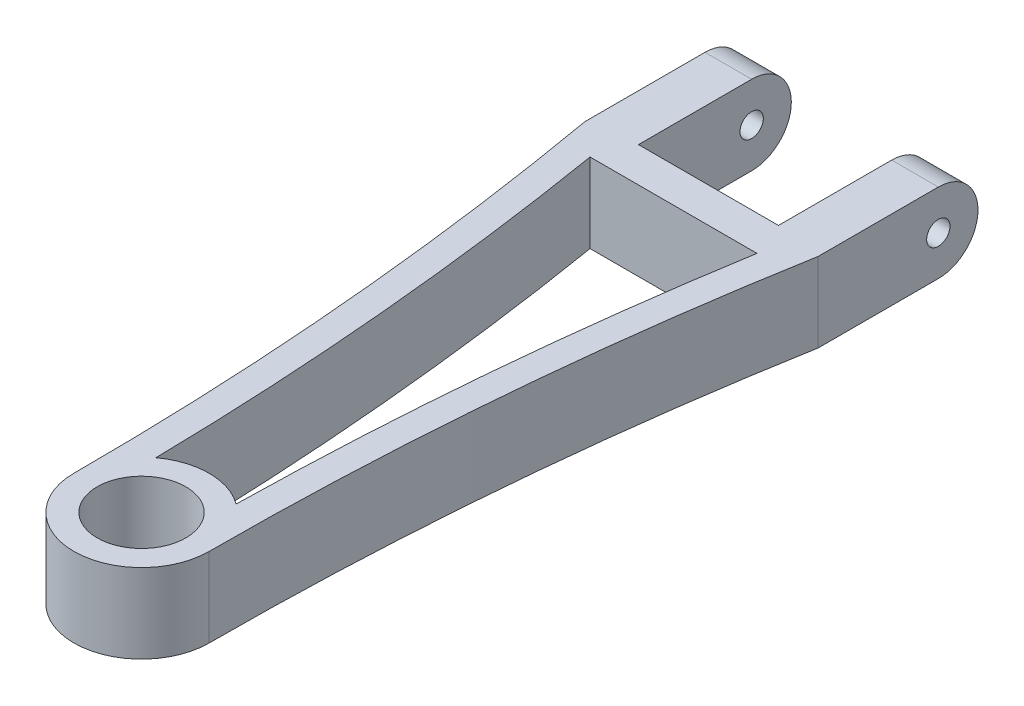
from build123d import *

# Parameters (mm, degrees)
SKETCH1_R               = 12.065
BOSS_EXTRUDE1_DEPTH     = 10.795
SKETCH5_W               = 38.1
SKETCH5_H               = 21.59
BOSS_EXTRUDE2_DEPTH     = 101.6
CUT_EXTRUDE1_REACH      = 261.255
SKETCH6_R               = 3.175
SKETCH4_W               = 12.7
SKETCH4_H               = 21.59
BOSS_EXTRUDE3_DEPTH     = 50.8
CUT_EXTRUDE2_DEPTH      = 210.73176208
CUT_EXTRUDE2_DEPTH_BACK = 210.73176208
SKETCH6_2_R             = 3.175
CUT_EXTRUDE3_DEPTH      = 214.164307578
CUT_EXTRUDE3_DEPTH_BACK = 214.164307578
CUT_EXTRUDE4_DEPTH      = 200.616791257
CUT_EXTRUDE4_DEPTH_BACK = 200.616791257


with BuildPart() as part:
    # Sketch1 → Boss-Extrude1 (new, symmetric)
    with BuildSketch(Plane(origin=(0, 0, 0), x_dir=(1, 0, 0), z_dir=(0, 1, 0))):
        with BuildLine():
            Line((-31.75, 152.4), (31.75, 152.4))
            ThreePointArc((31.75, 152.4), (21.755106695, 76.491146914), (18.415, 0))
            ThreePointArc((18.415, 0), (0, -18.415), (-18.415, 0))
            ThreePointArc((-18.415, 0), (-21.755106695, 76.491146914), (-31.75, 152.4))
        make_face()
        Circle(SKETCH1_R, mode=Mode.SUBTRACT)
    extrude(amount=BOSS_EXTRUDE1_DEPTH, both=True)

    # Sketch5 → Boss-Extrude2 (add)
    with BuildSketch(Plane(origin=(0, 0, -152.4), x_dir=(-1, 0, 0), z_dir=(0, 0, -1))):
        Rectangle(SKETCH5_W, SKETCH5_H)
    extrude(amount=BOSS_EXTRUDE2_DEPTH)

    # Sketch6 → Cut-Extrude1 (cut, up to next)
    with BuildSketch(Plane(origin=(19.05, 0, 0), x_dir=(0, 0, -1), z_dir=(1, 0, 0)), mode=Mode.PRIVATE) as cut_extrude1_sk1:
        Polygon((152.4, -10.795), (154.288880246, 10.795), (254, 10.795), (254, -10.795), align=None)
        with Locations((185.094440123, 0)):
            Circle(SKETCH6_R, mode=Mode.SUBTRACT)
    cut_extrude1_tool1 = extrude(cut_extrude1_sk1.sketch, amount=-CUT_EXTRUDE1_REACH, mode=Mode.PRIVATE) & part.part
    add(cut_extrude1_tool1.solids().sort_by_distance((19.05, -0.034262, -203.945458))[0], mode=Mode.SUBTRACT)


with BuildPart() as cut_extrude1_piece_1:
    # of the separate pieces the step leaves, piece 1, a body of its own (cut_extrude1_pieces)
    add(part.part.solids().sort_by_distance((-31.75, -10.795, -152.4))[0])

    # Sketch4 → Boss-Extrude3 (add)
    with BuildSketch(Plane(origin=(0, 0, -152.4), x_dir=(-1, 0, 0), z_dir=(0, 0, -1))):
        with Locations((-25.4, 0)):
            Rectangle(SKETCH4_W, SKETCH4_H)
        with Locations((25.4, 0)):
            Rectangle(SKETCH4_W, SKETCH4_H)
    extrude(amount=BOSS_EXTRUDE3_DEPTH)


with BuildPart() as cut_extrude1_piece_2:
    # of the separate pieces the step leaves, piece 2, a body of its own (cut_extrude1_pieces)
    add(part.part.solids().sort_by_distance((-19.05, 0, -188.269440123))[0])


with BuildPart() as cut_extrude2_tool:
    # Sketch6<2> → Cut-Extrude2 (new, two sides: drawn at the far end of the back side and taken through both)
    with BuildSketch(Plane(origin=(19.05, 0, 0), x_dir=(0, 0, -1), z_dir=(1, 0, 0)).offset(-CUT_EXTRUDE2_DEPTH_BACK)):
        with Locations((185.094440123, 0)):
            Circle(SKETCH6_2_R)
    extrude(amount=CUT_EXTRUDE2_DEPTH + CUT_EXTRUDE2_DEPTH_BACK)


with BuildPart() as cut_extrude1_piece_1_1:
    add(cut_extrude1_piece_1.part)

    # Cut-Extrude2: cut by cut_extrude2_tool
    add(cut_extrude2_tool.part, mode=Mode.SUBTRACT)

    # Sketch7 → Cut-Extrude3 (cut, two sides: drawn at the far end of the back side and taken through both)
    with BuildSketch(Plane(origin=(31.75, 0, 0), x_dir=(0, 0, -1), z_dir=(1, 0, 0)).offset(-CUT_EXTRUDE3_DEPTH_BACK)):
        with BuildLine():
            Line((203.2, 10.795), (185.094440123, 10.795))
            ThreePointArc((185.094440123, 10.795), (192.727657826, 7.633217703), (195.889440123, 0))
            ThreePointArc((195.889440123, 0), (192.727657826, -7.633217703), (185.094440123, -10.795))
            Line((185.094440123, -10.795), (203.2, -10.795))
            Line((203.2, -10.795), (203.2, 10.795))
        make_face()
    extrude(amount=CUT_EXTRUDE3_DEPTH + CUT_EXTRUDE3_DEPTH_BACK, mode=Mode.SUBTRACT)

    # Sketch8 → Cut-Extrude4 (cut, two sides: drawn at the far end of the back side and taken through both)
    with BuildSketch(Plane.XZ.offset(10.795).offset(-CUT_EXTRUDE4_DEPTH_BACK)):
        with BuildLine():
            ThreePointArc((-10.919216068, -14.828450541), (-14.419629325, -80.021900258), (-22.715851164, -144.78))
            Line((-22.715851164, -144.78), (22.715851164, -144.78))
            ThreePointArc((22.715851164, -144.78), (14.419629325, -80.021900258), (10.919216068, -14.828450541))
            ThreePointArc((10.919216068, -14.828450541), (0, -18.415), (-10.919216068, -14.828450541))
        make_face()
    extrude(amount=CUT_EXTRUDE4_DEPTH + CUT_EXTRUDE4_DEPTH_BACK, mode=Mode.SUBTRACT)


with BuildPart() as cut_extrude1_piece_2_1:
    add(cut_extrude1_piece_2.part)

    # Cut-Extrude2: cut by cut_extrude2_tool
    add(cut_extrude2_tool.part, mode=Mode.SUBTRACT)


solid = cut_extrude1_piece_1_1.part
